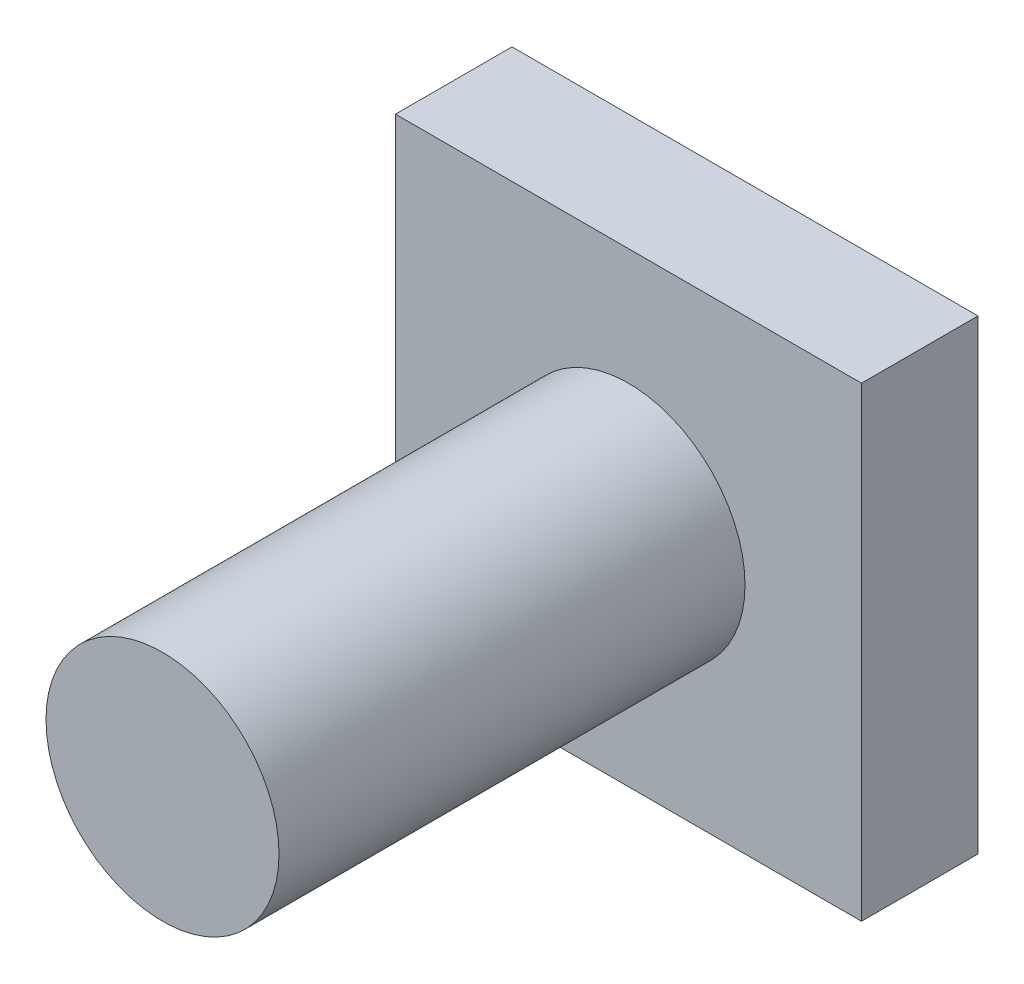
from build123d import *

# Parameters (mm, degrees)
SKETCH_1_R      = 5
EXTRUDE_1_DEPTH = 10
SKETCH_2_W      = 20
SKETCH_2_H      = 20
EXTRUDE_2_DEPTH = 5


with BuildPart() as part:
    # 草图1 → 凸台-拉伸1 (new, symmetric)
    with BuildSketch(Plane.XY):
        Circle(SKETCH_1_R)
    extrude(amount=EXTRUDE_1_DEPTH, both=True)

    # 草图2 → 凸台-拉伸2 (add)
    with BuildSketch(Plane(origin=(0, 0, -10), x_dir=(-1, 0, 0), z_dir=(0, 0, -1))):
        Rectangle(SKETCH_2_W, SKETCH_2_H)
    extrude(amount=EXTRUDE_2_DEPTH)


solid = part.part
